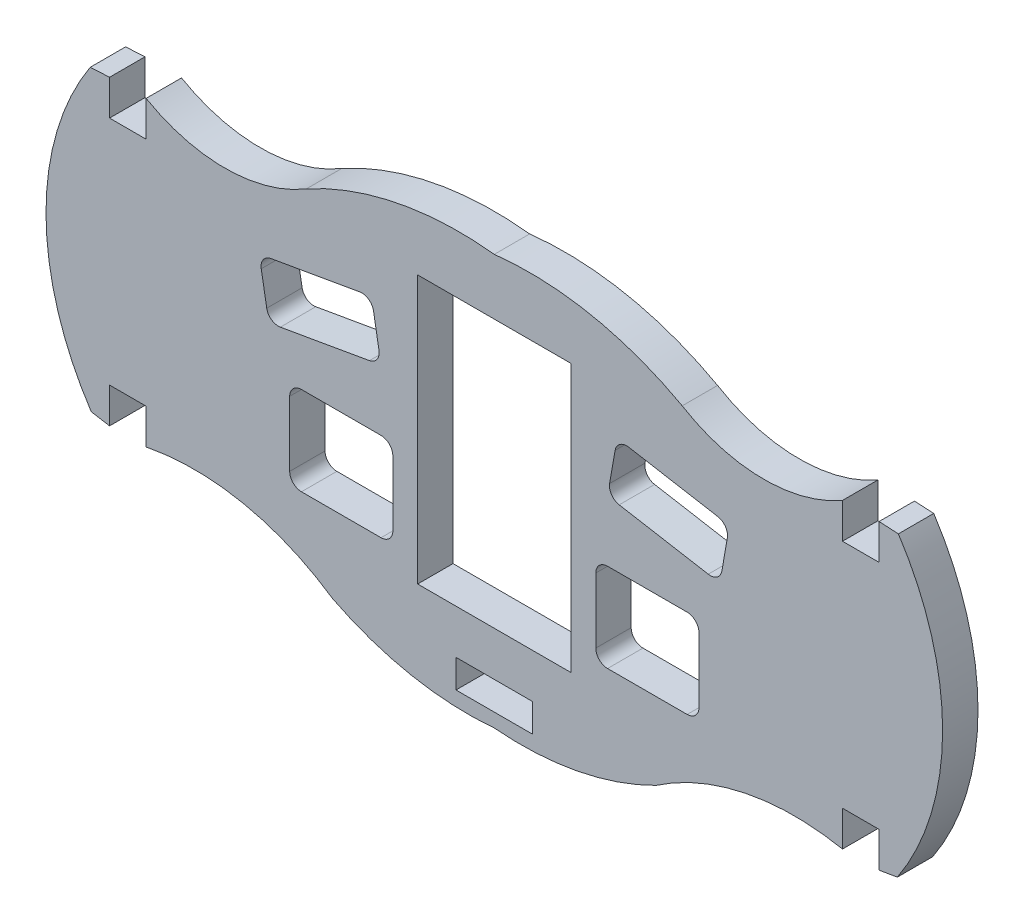
from build123d import *

# Parameters (mm, degrees)
BOSS_EXTRUDE1_DEPTH = 3
SKETCH2_W           = 13
SKETCH2_H           = 22.7
SKETCH2_W_2         = 6.499
SKETCH2_H_2         = 2.399
CUT_EXTRUDE1_DEPTH  = 3


with BuildPart() as part:
    # Sketch1 → Boss-Extrude1 (new body)
    with BuildSketch(Plane.XY):
        with BuildLine():
            ThreePointArc((-27.048045715, 1.346978667), (-23.229413898, -7.644456097), (-16.294351646, -14.524336884))
            ThreePointArc((-16.294351646, -14.524336884), (-14.971129192, -15.233831637), (-13.702557421, -16.036966825))
            ThreePointArc((-13.702557421, -16.036966825), (-7.036411487, -18.317683791), (0, -18.675573281))
            ThreePointArc((0, -18.675573281), (7.036411487, -18.317683791), (13.702557421, -16.036966825))
            ThreePointArc((13.702557421, -16.036966825), (14.971129192, -15.233831637), (16.294351646, -14.524336884))
            ThreePointArc((16.294351646, -14.524336884), (23.229413898, -7.644456097), (27.048045715, 1.346978667))
            ThreePointArc((27.048045715, 1.346978667), (22.641390956, 7.722324922), (16.597159635, 12.573192245))
            ThreePointArc((16.597159635, 12.573192245), (16.261784348, 12.757647773), (15.931841919, 12.951654004))
            ThreePointArc((15.931841919, 12.951654004), (8.210400332, 15.763932748), (0, 16.108749071))
            ThreePointArc((0, 16.108749071), (-8.210400332, 15.763932748), (-15.931841919, 12.951654004))
            ThreePointArc((-15.931841919, 12.951654004), (-16.261784348, 12.757647773), (-16.597159635, 12.573192245))
            ThreePointArc((-16.597159635, 12.573192245), (-22.641390956, 7.722324922), (-27.048045715, 1.346978667))
        make_face()
        with BuildLine():
            Line((29.524, 9.802), (29.524, -9.802))
            Line((29.524, -9.802), (32.624, -9.802))
            Line((32.624, -9.802), (32.624, -12.802))
            Line((32.624, -12.802), (34.17489845, -12.539239659))
            ThreePointArc((34.17489845, -12.539239659), (38.013587392, 0.074463168), (34.262667869, 12.714543648))
            Line((34.262667869, 12.714543648), (32.624, 12.802))
            Line((32.624, 12.802), (32.624, 9.802))
            Line((32.624, 9.802), (29.524, 9.802))
        make_face()
        with BuildLine():
            ThreePointArc((27.048045715, 1.346978667), (23.229413898, -7.644456097), (16.294351646, -14.524336884))
            ThreePointArc((16.294351646, -14.524336884), (22.767282146, -12.573251909), (29.524, -12.802))
            Line((29.524, -12.802), (29.524, -9.802))
            Line((29.524, -9.802), (29.524, 9.802))
            Line((29.524, 9.802), (29.524, 12.802))
            ThreePointArc((29.524, 12.802), (23.09016911, 11.015904248), (16.597159635, 12.573192245))
            ThreePointArc((16.597159635, 12.573192245), (22.641390956, 7.722324922), (27.048045715, 1.346978667))
        make_face()
        with BuildLine():
            Line((-29.524, -9.802), (-29.524, -12.802))
            ThreePointArc((-29.524, -12.802), (-22.767282146, -12.573251909), (-16.294351646, -14.524336884))
            ThreePointArc((-16.294351646, -14.524336884), (-23.229413898, -7.644456097), (-27.048045715, 1.346978667))
            ThreePointArc((-27.048045715, 1.346978667), (-22.641390956, 7.722324922), (-16.597159635, 12.573192245))
            ThreePointArc((-16.597159635, 12.573192245), (-23.09016911, 11.015904248), (-29.524, 12.802))
            Line((-29.524, 12.802), (-29.524, 9.802))
            Line((-29.524, 9.802), (-29.524, -9.802))
        make_face()
        with BuildLine():
            Line((-32.624, -9.802), (-29.524, -9.802))
            Line((-29.524, -9.802), (-29.524, 9.802))
            Line((-29.524, 9.802), (-32.624, 9.802))
            Line((-32.624, 9.802), (-32.624, 12.802))
            Line((-32.624, 12.802), (-34.262667869, 12.714543648))
            ThreePointArc((-34.262667869, 12.714543648), (-38.013587392, 0.074463168), (-34.17489845, -12.539239659))
            Line((-34.17489845, -12.539239659), (-32.624, -12.802))
            Line((-32.624, -12.802), (-32.624, -9.802))
        make_face()
    extrude(amount=-BOSS_EXTRUDE1_DEPTH)

    # Sketch2 → Cut-Extrude1 (cut)
    with BuildSketch(Plane.XY):
        with BuildLine():
            ThreePointArc((-18.140073475, 1.691900685), (-18.886998155, 1.858903562), (-19.297064795, 2.505147934))
            Line((-19.297064795, 2.505147934), (-19.762150522, 5.170880716))
            ThreePointArc((-19.762150522, 5.170880716), (-19.595147646, 5.917805396), (-18.948903274, 6.327872035))
            Line((-18.948903274, 6.327872035), (-11.398949082, 7.645099315))
            ThreePointArc((-11.398949082, 7.645099315), (-10.652024403, 7.478096438), (-10.241957763, 6.831852066))
            Line((-10.241957763, 6.831852066), (-9.776872035, 4.166119284))
            ThreePointArc((-9.776872035, 4.166119284), (-9.943874912, 3.419194604), (-10.590119284, 3.009127965))
            Line((-10.590119284, 3.009127965), (-18.140073475, 1.691900685))
        make_face()
        Rectangle(SKETCH2_W, SKETCH2_H)
        with BuildLine():
            ThreePointArc((-16.351, -9.502), (-17.058106781, -9.209106781), (-17.351, -8.502))
            Line((-17.351, -8.502), (-17.351, -2.991))
            ThreePointArc((-17.351, -2.991), (-17.058106781, -2.283893219), (-16.351, -1.991))
            Line((-16.351, -1.991), (-9.605, -1.991))
            ThreePointArc((-9.605, -1.991), (-8.897893219, -2.283893219), (-8.605, -2.991))
            Line((-8.605, -2.991), (-8.605, -8.502))
            ThreePointArc((-8.605, -8.502), (-8.897893219, -9.209106781), (-9.605, -9.502))
            Line((-9.605, -9.502), (-16.351, -9.502))
        make_face()
        with BuildLine():
            Line((9.605, -1.991), (16.351, -1.991))
            ThreePointArc((16.351, -1.991), (17.058106781, -2.283893219), (17.351, -2.991))
            Line((17.351, -2.991), (17.351, -8.502))
            ThreePointArc((17.351, -8.502), (17.058106781, -9.209106781), (16.351, -9.502))
            Line((16.351, -9.502), (9.605, -9.502))
            ThreePointArc((9.605, -9.502), (8.897893219, -9.209106781), (8.605, -8.502))
            Line((8.605, -8.502), (8.605, -2.991))
            ThreePointArc((8.605, -2.991), (8.897893219, -2.283893219), (9.605, -1.991))
        make_face()
        with BuildLine():
            ThreePointArc((10.241957763, 6.831852066), (10.652024403, 7.478096438), (11.398949082, 7.645099315))
            Line((11.398949082, 7.645099315), (18.948903274, 6.327872035))
            ThreePointArc((18.948903274, 6.327872035), (19.595147646, 5.917805396), (19.762150522, 5.170880716))
            Line((19.762150522, 5.170880716), (19.297064795, 2.505147934))
            ThreePointArc((19.297064795, 2.505147934), (18.886998155, 1.858903562), (18.140073475, 1.691900685))
            Line((18.140073475, 1.691900685), (10.590119284, 3.009127965))
            ThreePointArc((10.590119284, 3.009127965), (9.943874912, 3.419194604), (9.776872035, 4.166119284))
            Line((9.776872035, 4.166119284), (10.241957763, 6.831852066))
        make_face()
        with Locations((0, -16.3075)):
            Rectangle(SKETCH2_W_2, SKETCH2_H_2)
    extrude(amount=-CUT_EXTRUDE1_DEPTH, mode=Mode.SUBTRACT)


solid = part.part
